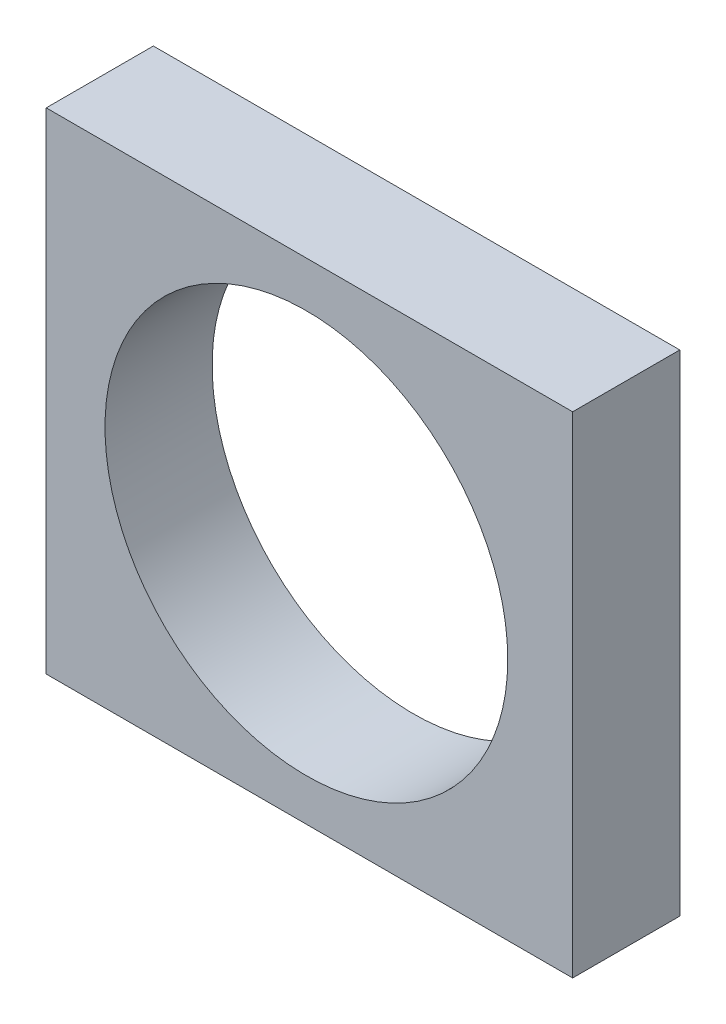
from build123d import *

# Parameters (mm, degrees)
ESQUISSE1_W        = 24.573059782
ESQUISSE1_H        = 22.889973495
ESQUISSE1_R        = 9.4
BOSS_EXTRU_1_DEPTH = 5


with BuildPart() as part:
    # Esquisse1 → Boss.-Extru.1 (new body)
    with BuildSketch(Plane.XY):
        with Locations((0.143025425, 0.084154315)):
            Rectangle(ESQUISSE1_W, ESQUISSE1_H)
        Circle(ESQUISSE1_R, mode=Mode.SUBTRACT)
    extrude(amount=BOSS_EXTRU_1_DEPTH)


solid = part.part
